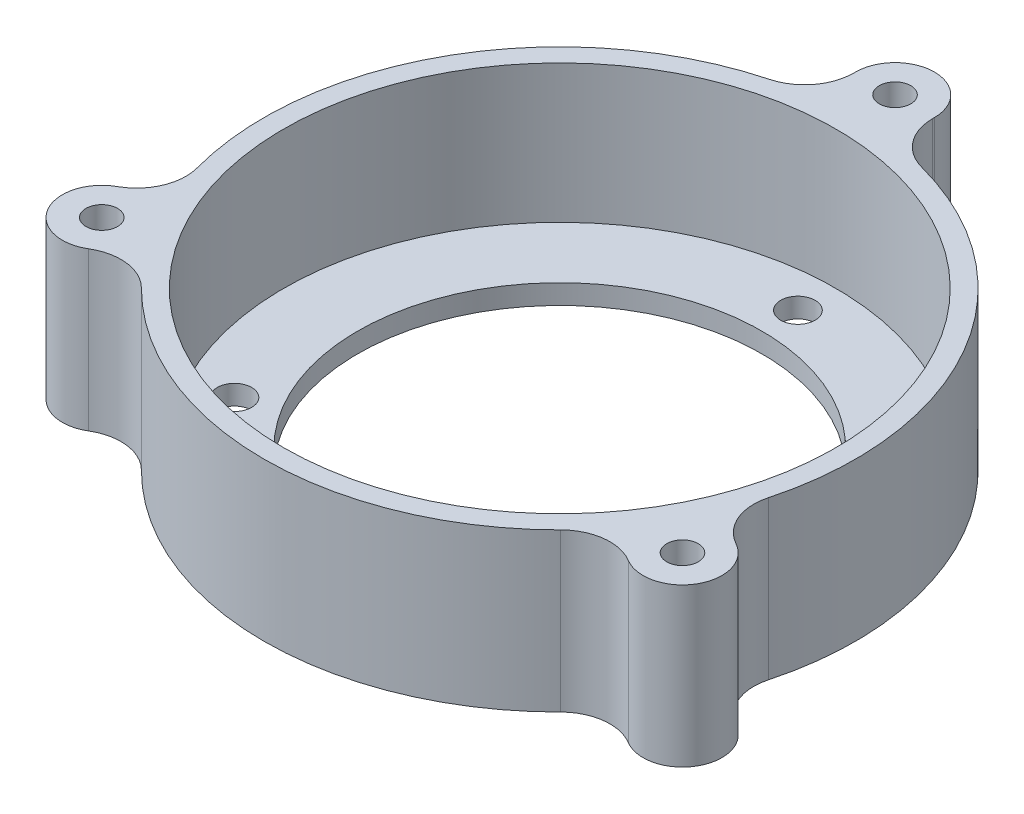
from build123d import *

# Parameters (mm, degrees)
SKETCH1_R           = 30
SKETCH1_R_2         = 20.5
BOSS_EXTRUDE1_DEPTH = 16
SKETCH2_R           = 28
CUT_EXTRUDE1_DEPTH  = 14
BOSS_EXTRUDE2_START = -16
SKETCH4_R           = 4
SKETCH4_R_2         = 1.6
BOSS_EXTRUDE2_DEPTH = 16
FILLET1_R           = 5
SKETCH5_R           = 1.75
CUT_EXTRUDE2_DEPTH  = 53.521985177


with BuildPart() as part:
    # Sketch1 → Boss-Extrude1 (new body)
    with BuildSketch(Plane(origin=(0, 0, 0), x_dir=(1, 0, 0), z_dir=(0, 1, 0))):
        with Locations(Location((0, 0, 0), (0, 0, 270))):
            Circle(SKETCH1_R)
        with Locations(Location((0, 0, 0), (0, 0, 270))):
            Circle(SKETCH1_R_2, mode=Mode.SUBTRACT)
    extrude(amount=BOSS_EXTRUDE1_DEPTH)

    # Sketch2 → Cut-Extrude1 (cut)
    with BuildSketch(Plane(origin=(0, 16, 0), x_dir=(1, 0, 0), z_dir=(0, 1, 0))):
        with Locations(Location((0, 0, 0), (0, 0, 270))):
            Circle(SKETCH2_R)
    extrude(amount=-CUT_EXTRUDE1_DEPTH, mode=Mode.SUBTRACT)

    # Sketch4 → Boss-Extrude2 (add)
    # profile 1 of 9: a face of its own
    with BuildSketch(Plane(origin=(0, 16, 0), x_dir=(1, 0, 0), z_dir=(0, 1, 0)).offset(BOSS_EXTRUDE2_START)):
        with Locations((-29.444863729, -17)):
            Circle(SKETCH4_R)
        with Locations(Location((-29.444863729, -17, 0), (0, 0, 270))):
            Circle(SKETCH4_R_2, mode=Mode.SUBTRACT)
    # profile 2 of 9: a face of its own
    with BuildSketch(Plane(origin=(0, 16, 0), x_dir=(1, 0, 0), z_dir=(0, 1, 0)).offset(BOSS_EXTRUDE2_START)):
        with BuildLine():
            ThreePointArc((-23.897530801, -18.135821504), (-24.988384694, -16.600621385), (-25.980762095, -15.000000032))
            ThreePointArc((-25.980762095, -15.000000032), (-25.581160419, -15.964723837), (-25.444863729, -17))
            ThreePointArc((-25.444863729, -17), (-25.92341304, -18.897204534), (-27.244556251, -20.340456107))
            Line((-27.244556251, -20.340456107), (-23.897530801, -18.135821504))
        make_face()
    # profile 3 of 9: a face of its own
    with BuildSketch(Plane(origin=(0, 16, 0), x_dir=(1, 0, 0), z_dir=(0, 1, 0)).offset(BOSS_EXTRUDE2_START)):
        with BuildLine():
            ThreePointArc((-25.980762095, -15.000000032), (-26.92494299, -13.230549686), (-27.748786379, -11.401967132))
            Line((-27.748786379, -11.401967132), (-31.444863729, -13.535898385))
            ThreePointArc((-31.444863729, -13.535898385), (-28.40958753, -13.1362967), (-25.980762095, -15.000000032))
        make_face()
    # profile 4 of 9: a face of its own
    with BuildSketch(Plane(origin=(0, 16, 0), x_dir=(1, 0, 0), z_dir=(0, 1, 0)).offset(BOSS_EXTRUDE2_START)):
        with Locations((0, 34)):
            Circle(SKETCH4_R)
        with Locations(Location((0, 34, 0), (0, 0, 270))):
            Circle(SKETCH4_R_2, mode=Mode.SUBTRACT)
    # profile 5 of 9: a face of its own
    with BuildSketch(Plane(origin=(0, 16, 0), x_dir=(1, 0, 0), z_dir=(0, 1, 0)).offset(BOSS_EXTRUDE2_START)):
        with BuildLine():
            Line((4, 29.732137495), (4, 34))
            ThreePointArc((4, 34), (2.828427119, 31.171572869), (-1.7e-08, 30))
            ThreePointArc((-1.7e-08, 30), (2.00447937, 29.932959467), (4, 29.732137495))
        make_face()
    # profile 6 of 9: a face of its own
    with BuildSketch(Plane(origin=(0, 16, 0), x_dir=(1, 0, 0), z_dir=(0, 1, 0)).offset(BOSS_EXTRUDE2_START)):
        with BuildLine():
            ThreePointArc((-1.7e-08, 30), (-2.828427131, 31.171572881), (-4, 34))
            Line((-4, 34), (-4, 29.732137495))
            ThreePointArc((-4, 29.732137495), (-2.004479388, 29.932959466), (-1.7e-08, 30))
        make_face()
    # profile 7 of 9: a face of its own
    with BuildSketch(Plane(origin=(0, 16, 0), x_dir=(1, 0, 0), z_dir=(0, 1, 0)).offset(BOSS_EXTRUDE2_START)):
        with BuildLine():
            ThreePointArc((27.244556251, -20.340456107), (25.552370926, -17.921140477), (25.980761986, -15.00000022))
            ThreePointArc((25.980761986, -15.00000022), (24.988384634, -16.600621476), (23.897530801, -18.135821504))
            Line((23.897530801, -18.135821504), (27.244556251, -20.340456107))
        make_face()
    # profile 8 of 9: a face of its own
    with BuildSketch(Plane(origin=(0, 16, 0), x_dir=(1, 0, 0), z_dir=(0, 1, 0)).offset(BOSS_EXTRUDE2_START)):
        with BuildLine():
            Line((31.237629839, -13.424249775), (27.74612946, -11.408431091))
            ThreePointArc((27.74612946, -11.408431091), (26.923401686, -13.233685868), (25.980761986, -15.00000022))
            ThreePointArc((25.980761986, -15.00000022), (28.296348137, -13.168432183), (31.237629839, -13.424249775))
        make_face()
    # profile 9 of 9: a face of its own
    with BuildSketch(Plane(origin=(0, 16, 0), x_dir=(1, 0, 0), z_dir=(0, 1, 0)).offset(BOSS_EXTRUDE2_START)):
        with Locations((29.444863729, -17)):
            Circle(SKETCH4_R)
        with Locations(Location((29.444863729, -17, 0), (0, 0, 270))):
            Circle(SKETCH4_R_2, mode=Mode.SUBTRACT)
    extrude(amount=BOSS_EXTRUDE2_DEPTH)

    # Fillet1
    fillet1_edges = [part.edges().sort_by_distance(p)[0] for p in [
        (23.897530801, 8, 18.135821504),
        (27.74612946, 8, 11.408431091),
        (4, 8, -29.732137495),
        (-4, 8, -29.732137495),
        (-27.748786379, 8, 11.401967132),
        (-23.897530801, 8, 18.135821504),
    ]]
    fillet(fillet1_edges, radius=FILLET1_R)

    # Sketch5 → Cut-Extrude2 (cut, through all)
    with BuildSketch(Plane(origin=(0, 2, 0), x_dir=(1, 0, 0), z_dir=(0, 1, 0))):
        with Locations(Location((0, 24.15056176, 0), (0, 0, 270))):
            Circle(SKETCH5_R)
        with Locations(Location((-20.915, -12.07528088, 0), (0, 0, 270))):
            Circle(SKETCH5_R)
        with Locations(Location((20.915, -12.07528088, 0), (0, 0, 270))):
            Circle(SKETCH5_R)
    extrude(amount=-CUT_EXTRUDE2_DEPTH, mode=Mode.SUBTRACT)


solid = part.part
